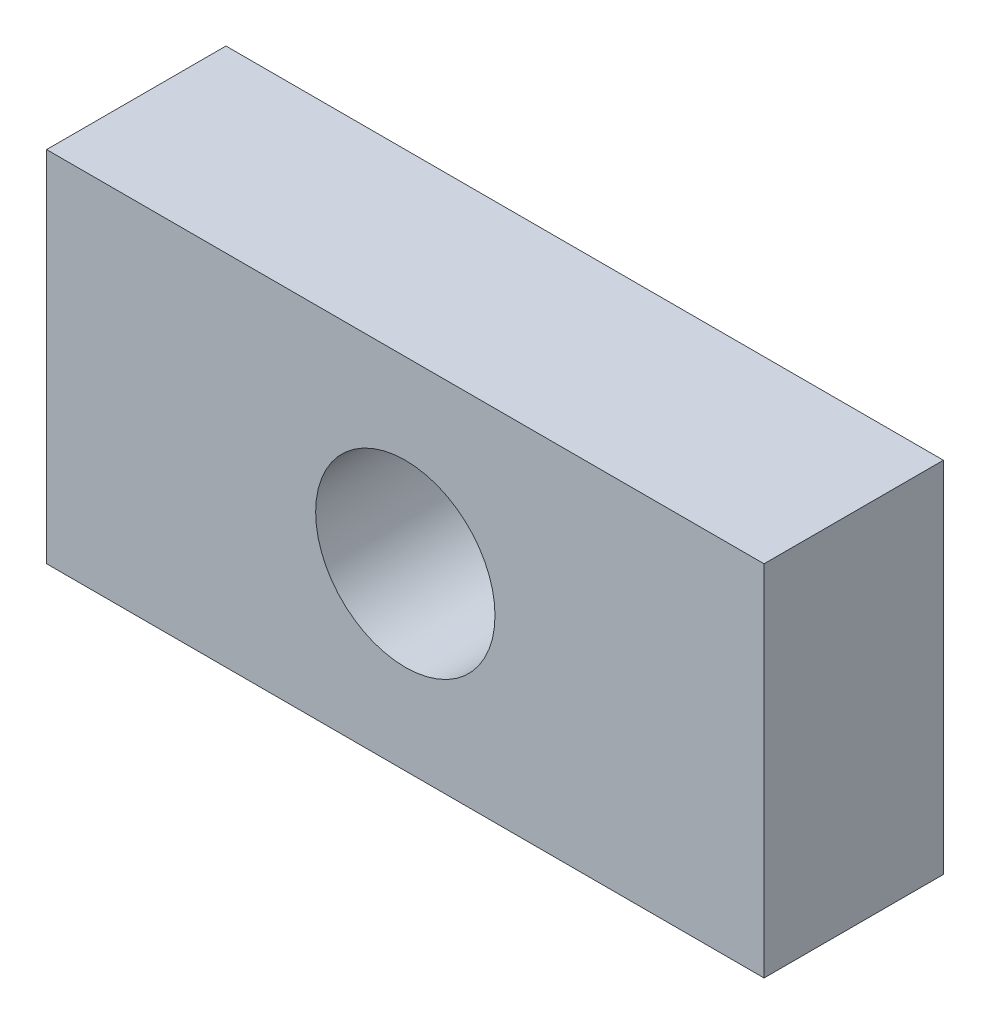
from build123d import *

# Parameters (mm, degrees)
SKETCH1_W               = 200
SKETCH1_H               = 100
BOSS_EXTRUDE1_DEPTH     = 50
CUT_EXTRUDE1_DEPTH      = 123.474487139
CUT_EXTRUDE1_DEPTH_BACK = 123.474487139
SKETCH1_3_R             = 25


with BuildPart() as part:
    # Sketch1 → Boss-Extrude1 (new body)
    with BuildSketch(Plane.XY):
        Rectangle(SKETCH1_W, SKETCH1_H)
    extrude(amount=BOSS_EXTRUDE1_DEPTH)

    # Sketch1<3> → Cut-Extrude1 (cut, two sides: drawn at the far end of the back side and taken through both)
    with BuildSketch(Plane.XY.offset(-CUT_EXTRUDE1_DEPTH_BACK)):
        Circle(SKETCH1_3_R)
    extrude(amount=CUT_EXTRUDE1_DEPTH + CUT_EXTRUDE1_DEPTH_BACK, mode=Mode.SUBTRACT)


solid = part.part
